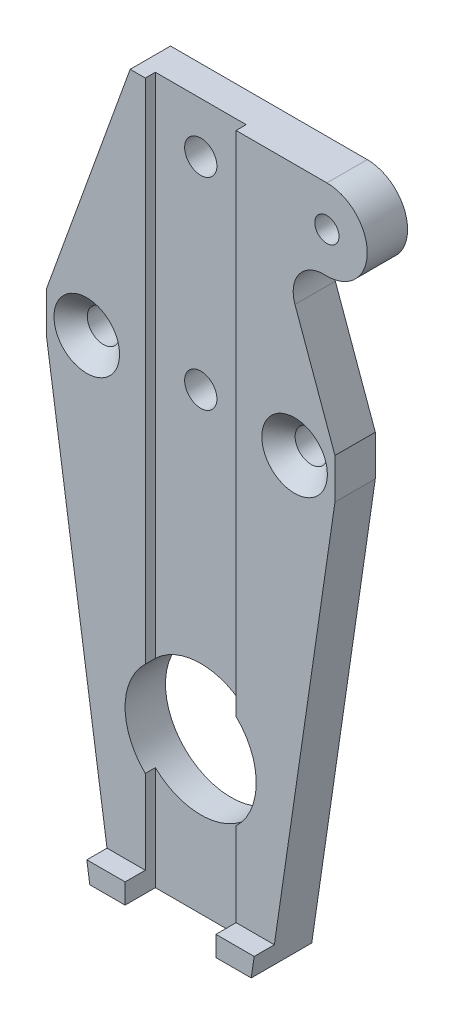
from build123d import *

# Parameters (mm, degrees)
MODEL_R           = 1.2
MODEL_R_2         = 1.6
EXTRUDE_1_DEPTH   = 4
EXTRUDE_1_2_DEPTH = 4
MODEL_11_R        = 1.6
EXTRUDE_3_DEPTH   = 3
EXTRUDE_4_DEPTH   = 6
CHAMFER_1_SIZE    = 1.65


with BuildPart() as part:
    # Model → 凸台-拉伸1 (new body)
    with BuildSketch(Plane.XY):
        with BuildLine():
            Line((36.699535099, 24.454545455), (37.040606061, 24.454545455))
            ThreePointArc((37.040606061, 24.454545455), (41.040606061, 28.454545455), (37.040606061, 32.454545455))
            Line((37.040606061, 32.454545455), (28.040606061, 32.454545455))
            Line((28.040606061, 32.454545455), (28.040606061, -17.855038786))
            ThreePointArc((28.040606061, -17.855038786), (30.040606061, -22.545454545), (28.040606061, -27.235870305))
            Line((28.040606061, -27.235870305), (28.040606061, -35.545454545))
            Line((28.04060606, -35.545454545), (31.833629316, -35.545454545))
            Line((31.833629316, -35.545454545), (37.840606061, 5.454545455))
            Line((37.840606061, 5.454545455), (37.840606061, 9.454545455))
            Line((37.840606061, 9.454545455), (33.877655721, 20.43621507))
            ThreePointArc((33.877655721, 20.43621507), (34.244439261, 23.178640702), (36.699535099, 24.454545455))
        make_face()
        with Locations((37.040606061, 28.454545455)):
            Circle(MODEL_R, mode=Mode.SUBTRACT)
        with Locations((33.840606061, 7.454545455)):
            Circle(MODEL_R_2, mode=Mode.SUBTRACT)
    extrude(amount=EXTRUDE_1_DEPTH)



with BuildPart() as body_2:
    # Model → Extrude 1 2 (new body)
    with BuildSketch(Plane.XY):
        with BuildLine():
            Line((19.040606061, -17.855038786), (19.040606061, 32.454545455))
            Line((19.040606061, 32.454545455), (17.540606061, 32.454545455))
            Line((17.540606061, 32.454545455), (9.240606061, 9.454545455))
            Line((9.240606061, 9.454545455), (9.240606061, 5.454545455))
            Line((9.240606061, 5.454545455), (15.247582805, -35.545454545))
            Line((15.247582805, -35.545454545), (19.040606061, -35.545454545))
            Line((19.040606061, -35.545454545), (19.040606061, -27.235870305))
            ThreePointArc((19.040606061, -27.235870305), (17.040606061, -22.545454545), (19.040606061, -17.855038786))
        make_face()
        with Locations((13.240606061, 7.454545455)):
            Circle(MODEL_R_2, mode=Mode.SUBTRACT)
    extrude(amount=EXTRUDE_1_2_DEPTH)


with BuildPart() as part_1:
    add(part.part)

    add(body_2.part)  # 凸台-拉伸3 merges body 2
    # Model<11> → 凸台-拉伸3 (add)
    # profile 1 of 4: a face of its own
    with BuildSketch(Plane.XY):
        with BuildLine():
            Line((28.040606061, -17.855038786), (28.040606061, 32.454545455))
            Line((28.040606061, 32.454545455), (19.040606061, 32.454545455))
            Line((19.040606061, 32.454545455), (19.040606061, -17.855038786))
            ThreePointArc((19.040606061, -17.855038786), (23.540606061, -16.045454545), (28.040606061, -17.855038786))
        make_face()
        with Locations((23.540606061, 7.454545455)):
            Circle(MODEL_11_R, mode=Mode.SUBTRACT)
        with Locations((23.540606061, 27.454545455)):
            Circle(MODEL_11_R, mode=Mode.SUBTRACT)
    # profile 2 of 4: a face of its own
    with BuildSketch(Plane.XY):
        with BuildLine():
            Line((28.040606061, -35.545454545), (28.040606061, -27.235870305))
            ThreePointArc((28.040606061, -27.235870305), (23.540606061, -29.045454545), (19.040606061, -27.235870305))
            Line((19.040606061, -27.235870305), (19.040606061, -35.545454545))
            Line((19.040606061, -35.545454545), (19.040606061, -37.545454545))
            Line((19.040606061, -37.545454545), (28.040606061, -37.545454545))
            Line((28.040606061, -37.545454545), (28.040606061, -35.545454545))
        make_face()
    # profile 3 of 4: a face of its own
    with BuildSketch(Plane.XY):
        Polygon((19.040606061, -37.545454545), (19.040606061, -35.545454545), (15.247582805, -35.545454545), (15.540606061, -37.545454545), align=None)
    # profile 4 of 4: a face of its own
    with BuildSketch(Plane.XY):
        Polygon((31.540606061, -37.545454545), (31.833629316, -35.545454545), (28.04060606, -35.545454545), (28.040606061, -37.545454545), align=None)
    extrude(amount=EXTRUDE_3_DEPTH)

    # Model<12> → 凸台-拉伸4 (add)
    with BuildSketch(Plane.XY):
        Polygon((19.040606061, -37.545454545), (19.040606061, -35.545454545), (15.247582805, -35.545454545), (15.540606061, -37.545454545), align=None)
        Polygon((31.540606061, -37.545454545), (31.833629316, -35.545454545), (28.04060606, -35.545454545), (28.040606061, -37.545454545), align=None)
    extrude(amount=EXTRUDE_4_DEPTH)

    # 倒角1
    chamfer_1_edges = [part_1.edges().sort_by_distance(p)[0] for p in [
        (32.240606061, 7.454545455, 4),
        (11.640606061, 7.454545455, 4),
    ]]
    chamfer(chamfer_1_edges, length=CHAMFER_1_SIZE)


solid = part_1.part
